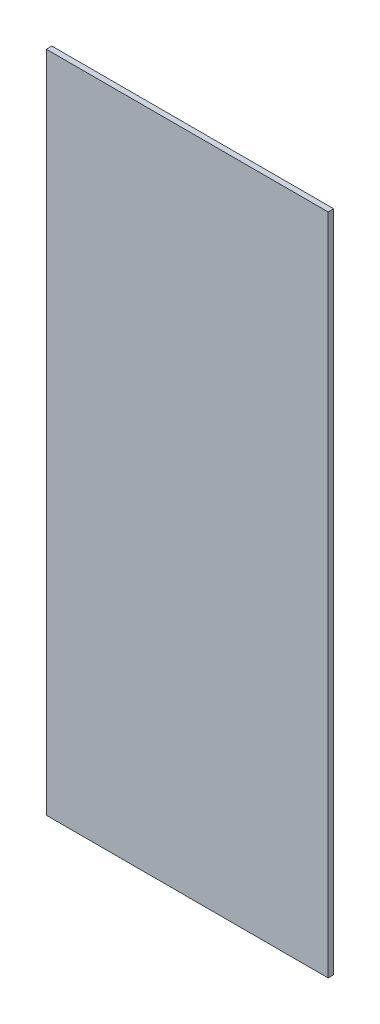
from build123d import *

# Parameters (mm, degrees)
SKETCH1_W           = 647.7
SKETCH1_H           = 1524
BOSS_EXTRUDE1_DEPTH = 12.7


with BuildPart() as part:
    # Sketch1 → Boss-Extrude1 (new body)
    with BuildSketch(Plane.XY):
        with Locations((-323.85, 762)):
            Rectangle(SKETCH1_W, SKETCH1_H)
    extrude(amount=BOSS_EXTRUDE1_DEPTH)


solid = part.part
